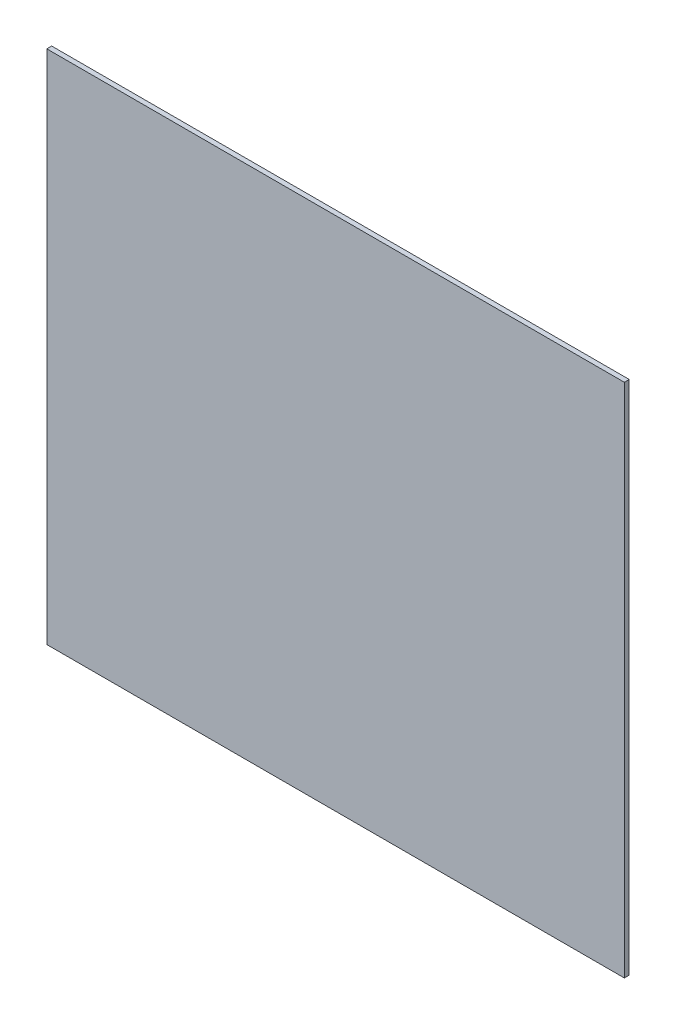
from build123d import *

# Parameters (mm, degrees)
ESQUISSE1_W        = 356
ESQUISSE1_H        = 318
BOSS_EXTRU_1_DEPTH = 3


with BuildPart() as part:
    # Esquisse1 → Boss.-Extru.1 (new body)
    with BuildSketch(Plane.XY):
        with Locations((9.753424658, -72.438356164)):
            Rectangle(ESQUISSE1_W, ESQUISSE1_H)
    extrude(amount=BOSS_EXTRU_1_DEPTH)


solid = part.part
